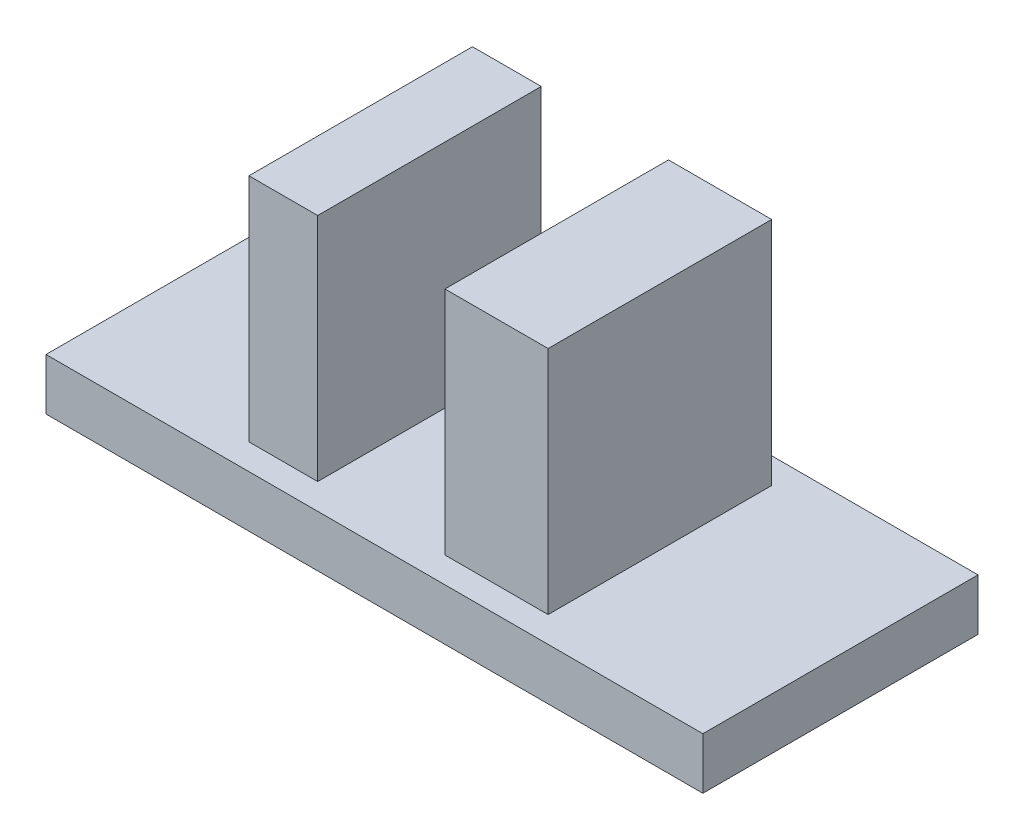
from build123d import *

# Parameters (mm, degrees)
SKIZZE1_R                       = 40
AUFSATZ_LINEAR_AUSTRAGEN1_DEPTH = 15
SKIZZE2_W                       = 30
SKIZZE2_H                       = 65
SKIZZE2_W_2                     = 20
AUFSATZ_LINEAR_AUSTRAGEN2_DEPTH = 67


with BuildPart() as part:
    # Skizze1 → Aufsatz-Linear austragen1 (new body)
    with BuildSketch(Plane(origin=(0, 0, 0), x_dir=(1, 0, 0), z_dir=(0, 1, 0))):
        with BuildLine():
            Line((-95.5, 40), (-95.5, -40))
            Line((-95.5, -40), (55.5, -40))
            ThreePointArc((55.5, -40), (15.5, 0), (55.5, 40))
            Line((55.5, 40), (-95.5, 40))
        make_face()
        with Locations((55.5, 0)):
            Circle(SKIZZE1_R)
        with BuildLine():
            Line((95.5, 40), (55.5, 40))
            ThreePointArc((55.5, 40), (83.784271247, 28.284271247), (95.5, 0))
            Line((95.5, 0), (95.5, 40))
        make_face()
        with BuildLine():
            ThreePointArc((95.5, 0), (83.784271247, -28.284271247), (55.5, -40))
            Line((55.5, -40), (95.5, -40))
            Line((95.5, -40), (95.5, 0))
        make_face()
    extrude(amount=AUFSATZ_LINEAR_AUSTRAGEN1_DEPTH)

    # Skizze2 → Aufsatz-Linear austragen2 (add)
    with BuildSketch(Plane(origin=(0, 15, 0), x_dir=(1, 0, 0), z_dir=(0, 1, 0))):
        with Locations((28, 0)):
            Rectangle(SKIZZE2_W, SKIZZE2_H)
        with Locations((-34, 0)):
            Rectangle(SKIZZE2_W_2, SKIZZE2_H)
    extrude(amount=AUFSATZ_LINEAR_AUSTRAGEN2_DEPTH)


solid = part.part
